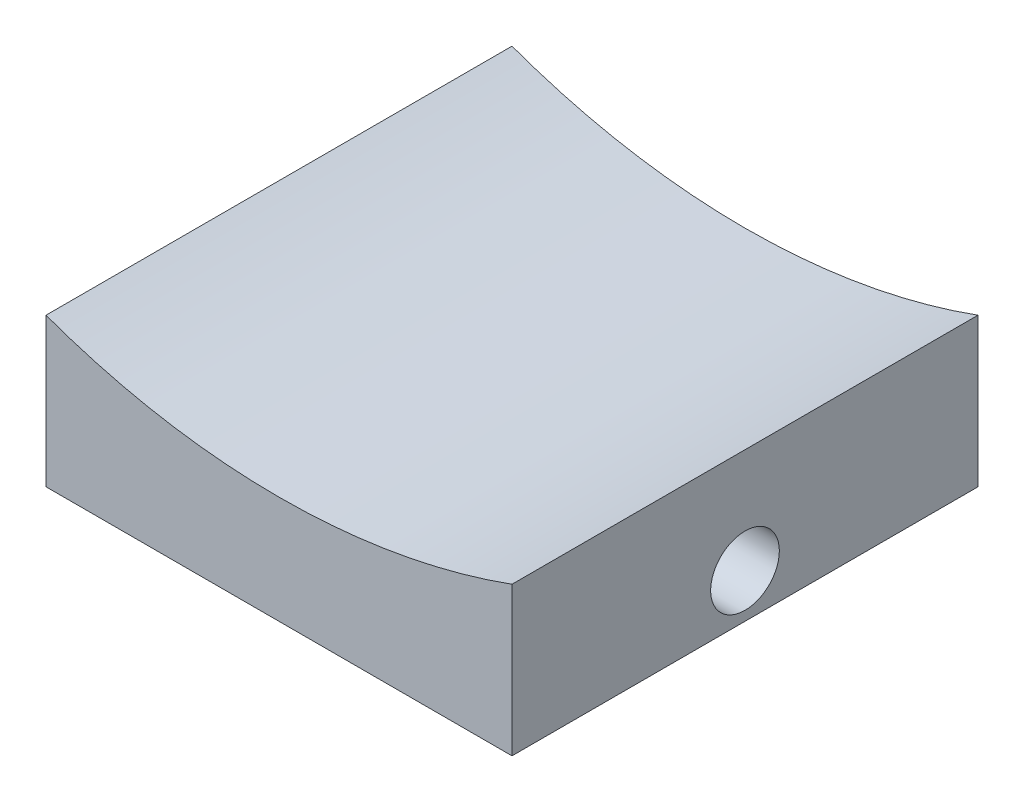
from build123d import *

# Parameters (mm, degrees)
SKIZZE1_W                       = 65
SKIZZE1_H                       = 30
AUFSATZ_LINEAR_AUSTRAGEN1_DEPTH = 65
SKIZZE2_R                       = 95
SCHNITT_LINEAR_AUSTRAGEN1_DEPTH = 65
SKIZZE5_R                       = 4.79
SCHNITT_LINEAR_AUSTRAGEN2_DEPTH = 34.98


with BuildPart() as part:
    # Skizze1 → Aufsatz-Linear austragen1 (new body)
    with BuildSketch(Plane.XY):
        Rectangle(SKIZZE1_W, SKIZZE1_H)
    extrude(amount=AUFSATZ_LINEAR_AUSTRAGEN1_DEPTH)

    # Skizze2 → Schnitt-Linear austragen1 (cut)
    with BuildSketch(Plane.XY.offset(65)):
        with Locations((0, 95)):
            Circle(SKIZZE2_R)
    extrude(amount=-SCHNITT_LINEAR_AUSTRAGEN1_DEPTH, mode=Mode.SUBTRACT)

    # Skizze5 → Schnitt-Linear austragen2 (cut)
    with BuildSketch(Plane(origin=(32.5, 0, 0), x_dir=(0, 0, -1), z_dir=(1, 0, 0))):
        with Locations((-32.5, -8.88)):
            Circle(SKIZZE5_R)
    extrude(amount=-SCHNITT_LINEAR_AUSTRAGEN2_DEPTH, mode=Mode.SUBTRACT)


solid = part.part
